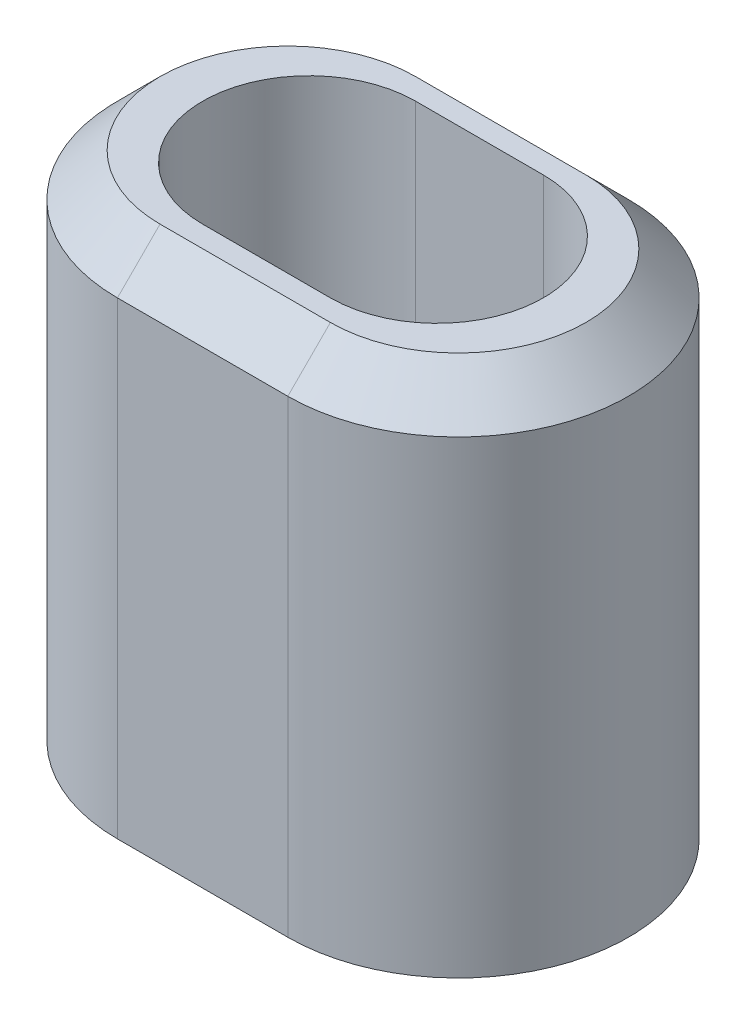
from build123d import *

# Parameters (mm, degrees)
SALIENTE_EXTRUIR1_DEPTH = 60
CHAFL_N1_SIZE           = 5


with BuildPart() as part:
    # Croquis1 → Saliente-Extruir1 (new body)
    with BuildSketch(Plane(origin=(0, 0, 0), x_dir=(1, 0, 0), z_dir=(0, 1, 0))):
        with BuildLine():
            Line((0, -20), (-20, -20))
            ThreePointArc((-20, -20), (-40, 0), (-20, 20))
            Line((-20, 20), (0, 20))
            ThreePointArc((0, 20), (20, 0), (0, -20))
        make_face()
        with BuildLine():
            Line((-2.5, -12.5), (-17.5, -12.5))
            ThreePointArc((-17.5, -12.5), (-30, 0), (-17.5, 12.5))
            Line((-17.5, 12.5), (-2.5, 12.5))
            ThreePointArc((-2.5, 12.5), (10, 0), (-2.5, -12.5))
        make_face(mode=Mode.SUBTRACT)
    extrude(amount=SALIENTE_EXTRUIR1_DEPTH)

    # Chaflán1
    chafl_n1_edges = [part.edges().sort_by_distance(p)[0] for p in [
        (-40, 60, 0),
        (-10, 60, 20),
        (20, 60, 0),
        (-10, 60, -20),
    ]]
    chamfer(chafl_n1_edges, length=CHAFL_N1_SIZE)


solid = part.part
